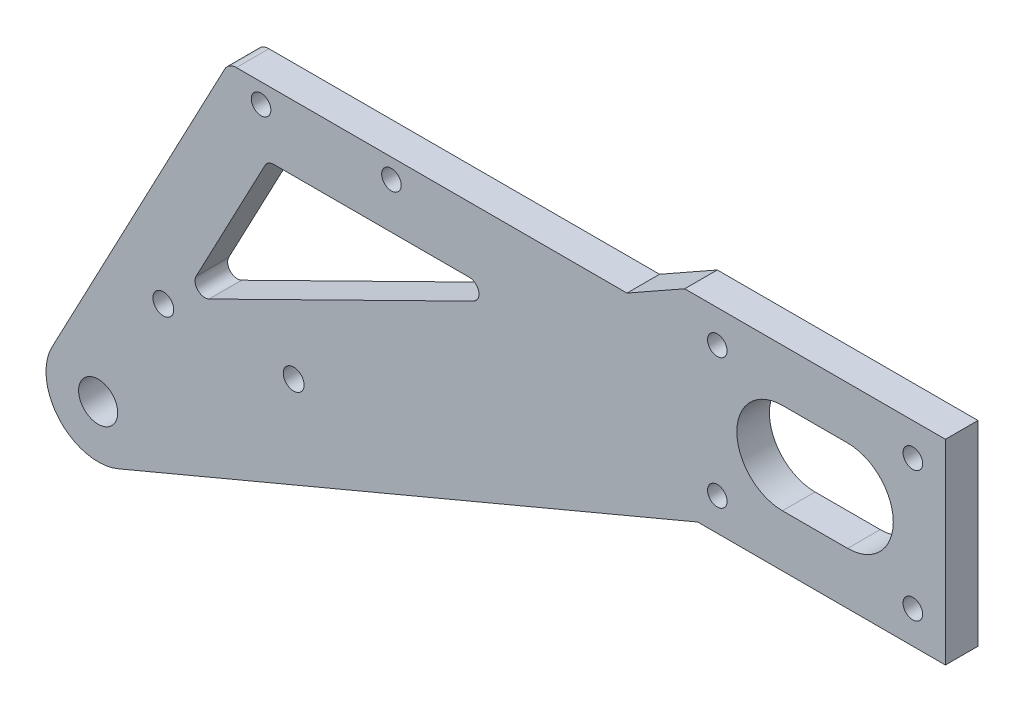
from build123d import *

# Parameters (mm, degrees)
SKETCH_1_R          = 3
SKETCH_1_R_2        = 1.5
EXTRUDE_1_DEPTH     = 5
EXTRUDE_2_DEPTH     = 5
SKETCH_4_R          = 1.5
CUT_EXTRUDE_1_DEPTH = 144.265487819
EXTRUDE_START       = -5
EXTRUDE_3_DEPTH     = 5
CUT_EXTRUDE_2_DEPTH = 144.265487819
SKETCH_7_R          = 1.6
CUT_EXTRUDE_3_DEPTH = 144.265487819
FILLET_1_R          = 2


with BuildPart() as part:
    # 草图1 → 凸台-拉伸1 (new body)
    with BuildSketch(Plane.XY):
        with BuildLine():
            Line((-3.933140204, 6.966376973), (90, 60))
            Line((90, 60), (130, 60))
            Line((130, 60), (130, 30))
            Line((130, 30), (92, 30))
            Line((92, 30), (3.100465808, -7.374761811))
            ThreePointArc((3.100465808, -7.374761811), (-7.182645896, -3.522725923), (-3.933140204, 6.966376973))
        make_face()
        Circle(SKETCH_1_R, mode=Mode.SUBTRACT)
        with Locations((95, 55)):
            Circle(SKETCH_1_R_2, mode=Mode.SUBTRACT)
        with Locations((125, 55)):
            Circle(SKETCH_1_R_2, mode=Mode.SUBTRACT)
        with Locations((125, 35)):
            Circle(SKETCH_1_R_2, mode=Mode.SUBTRACT)
        with Locations((95, 35)):
            Circle(SKETCH_1_R_2, mode=Mode.SUBTRACT)
    extrude(amount=EXTRUDE_1_DEPTH)

    # 草图3 → 凸台-拉伸2 (add)
    with BuildSketch(Plane.XY.offset(5)):
        Polygon((81.144001216, 55), (20, 55), (20, 20.478766027), align=None)
    extrude(amount=-EXTRUDE_2_DEPTH)

    # 草图4 → 切除-拉伸1 (cut, through all)
    with BuildSketch(Plane.XY.offset(5)):
        with Locations((25, 52)):
            Circle(SKETCH_4_R)
        with Locations((45, 52)):
            Circle(SKETCH_4_R)
    extrude(amount=-CUT_EXTRUDE_1_DEPTH, mode=Mode.SUBTRACT)

    # 草图6 → 凸台-拉伸3 (add)
    with BuildSketch(Plane.XY.offset(5).offset(EXTRUDE_START)):
        with BuildLine():
            Line((-7.074049095, 3.736017853), (20, 55))
            Line((20, 55), (20, 20.478766027))
            Line((20, 20.478766027), (-3.933140204, 6.966376973))
            ThreePointArc((-3.933140204, 6.966376973), (-5.735709118, 5.576884517), (-7.074049095, 3.736017853))
        make_face()
    extrude(amount=EXTRUDE_3_DEPTH)

    # 草图5 → 切除-拉伸2 (cut, through all)
    with BuildSketch(Plane.XY.offset(5)):
        with BuildLine():
            Line((105, 52), (115, 52))
            ThreePointArc((115, 52), (122, 45), (115, 38))
            Line((115, 38), (105, 38))
            ThreePointArc((105, 38), (98, 45), (105, 52))
        make_face()
        with BuildLine():
            Line((25.605401824, 44.200503347), (15.042800964, 24.200503347))
            ThreePointArc((15.042800964, 24.200503347), (15.293877797, 22.454192152), (17.032531201, 22.154647985))
            Line((17.032531201, 22.154647985), (57.595132061, 42.154647985))
            ThreePointArc((57.595132061, 42.154647985), (58.392612512, 43.840567158), (56.93178603, 45))
            Line((56.93178603, 45), (26.93178603, 45))
            ThreePointArc((26.93178603, 45), (26.157433081, 44.784670195), (25.605401824, 44.200503347))
        make_face()
    extrude(amount=-CUT_EXTRUDE_2_DEPTH, mode=Mode.SUBTRACT)

    # 草图7 → 切除-拉伸3 (cut, through all)
    with BuildSketch(Plane.XY.offset(5)):
        with Locations((10, 18)):
            Circle(SKETCH_7_R)
        with Locations((30, 18)):
            Circle(SKETCH_7_R)
    extrude(amount=-CUT_EXTRUDE_3_DEPTH, mode=Mode.SUBTRACT)

    # 圆角1
    fillet_1_edges = [part.edges().sort_by_distance(p)[0] for p in [
        (20, 55, 2.5),
    ]]
    fillet(fillet_1_edges, radius=FILLET_1_R)


solid = part.part
